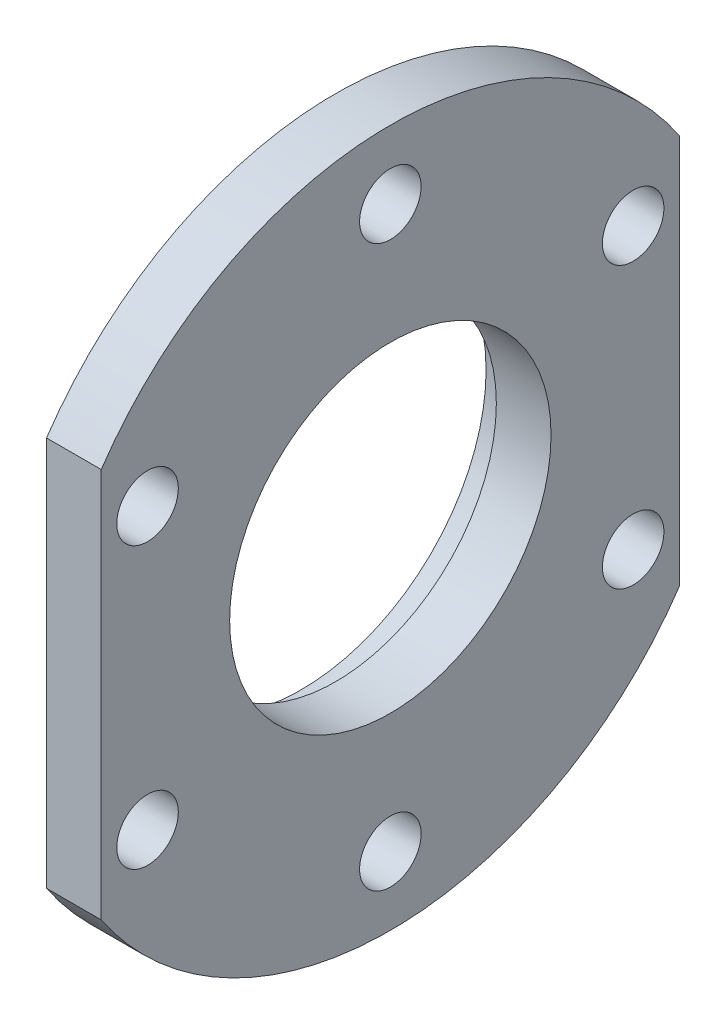
from build123d import *

# Parameters (mm, degrees)
SKETCH_1_R          = 23.5
SKETCH_1_R_2        = 4.5
EXTRUDE_1_DEPTH     = 8
SKETCH_2_R          = 31
EXTRUDE_2_DEPTH     = 5
FILLET_1_R          = 0.5
SKETCH_3_R          = 27
CUT_EXTRUDE_1_DEPTH = 67.728373836


with BuildPart() as part:
    # 草图1 → 凸台-拉伸1 (new body)
    with BuildSketch(Plane(origin=(0, 0, 0), x_dir=(0, 0, -1), z_dir=(1, 0, 0))):
        with BuildLine():
            Line((42.2809162, 28.518838077), (42.2809162, -28.518838077))
            ThreePointArc((42.2809162, -28.518838077), (0, -51), (-42.2809162, -28.518838077))
            Line((-42.2809162, -28.518838077), (-42.2809162, 28.518838077))
            ThreePointArc((-42.2809162, 28.518838077), (0, 51), (42.2809162, 28.518838077))
        make_face()
        Circle(SKETCH_1_R, mode=Mode.SUBTRACT)
        with Locations((0, 41)):
            Circle(SKETCH_1_R_2, mode=Mode.SUBTRACT)
        with Locations((35.507041555, 20.5)):
            Circle(SKETCH_1_R_2, mode=Mode.SUBTRACT)
        with Locations((35.507041555, -20.5)):
            Circle(SKETCH_1_R_2, mode=Mode.SUBTRACT)
        with Locations((0, -41)):
            Circle(SKETCH_1_R_2, mode=Mode.SUBTRACT)
        with Locations((-35.507041555, -20.5)):
            Circle(SKETCH_1_R_2, mode=Mode.SUBTRACT)
        with Locations((-35.507041555, 20.5)):
            Circle(SKETCH_1_R_2, mode=Mode.SUBTRACT)
    extrude(amount=EXTRUDE_1_DEPTH)

    # 草图2 → 凸台-拉伸2 (add)
    with BuildSketch(Plane.ZY):
        with Locations(Location((0, 0, 0), (0, 0, 180))):
            Circle(SKETCH_2_R)
    extrude(amount=EXTRUDE_2_DEPTH)

    # 圆角1
    fillet_1_edges = [part.edges().sort_by_distance(p)[0] for p in [
        (-5, 0, 31),
    ]]
    fillet(fillet_1_edges, radius=FILLET_1_R)

    # 草图3 → 切除-拉伸1 (cut, through all)
    with BuildSketch(Plane(origin=(0, 0, 0), x_dir=(0, 0, -1), z_dir=(1, 0, 0))):
        Circle(SKETCH_3_R)
    extrude(amount=-CUT_EXTRUDE_1_DEPTH, mode=Mode.SUBTRACT)


solid = part.part
